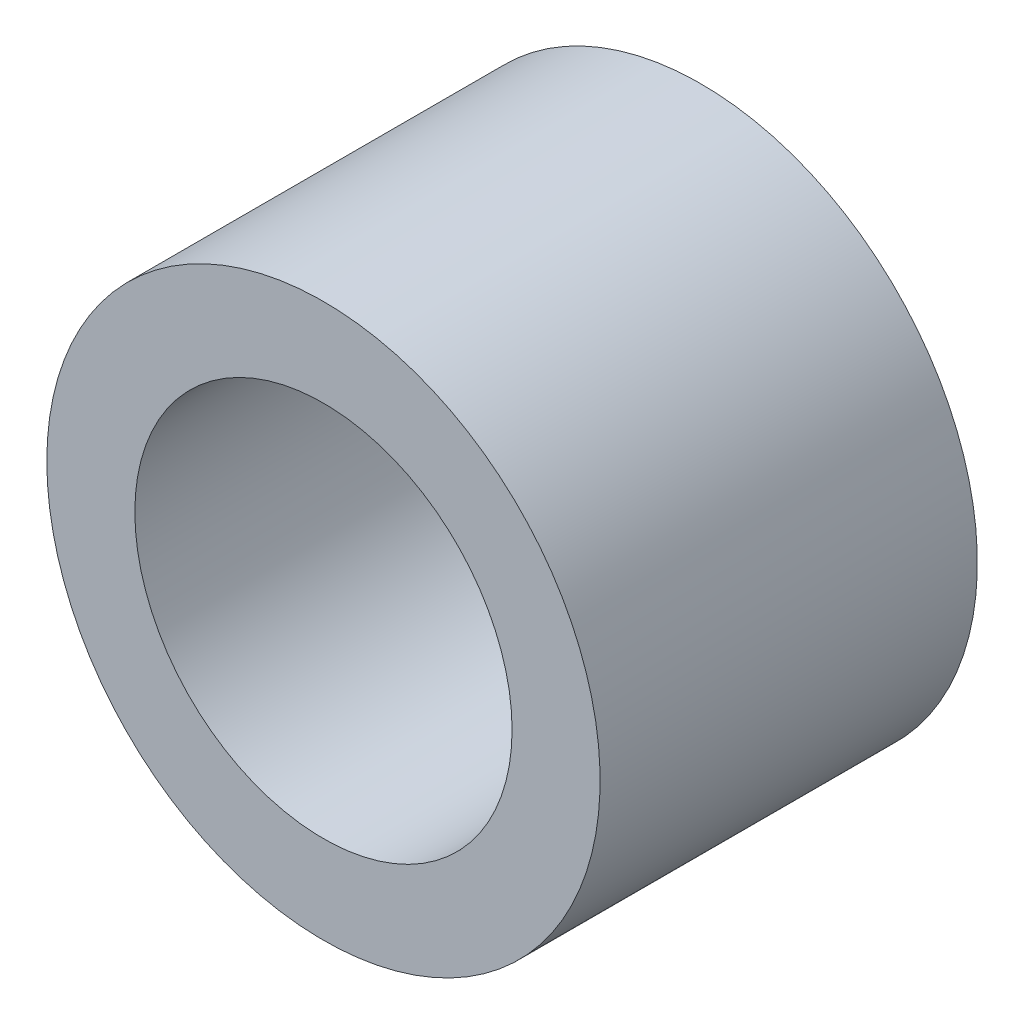
from build123d import *

# Parameters (mm, degrees)
SKETCH1_R           = 5.588
SKETCH1_R_2         = 3.81
BOSS_EXTRUDE1_DEPTH = 7.62


with BuildPart() as part:
    # Sketch1 → Boss-Extrude1 (new body)
    with BuildSketch(Plane.XY):
        with Locations(Location((0, 0, 0), (0, 0, 180))):
            Circle(SKETCH1_R)
        with Locations(Location((0, 0, 0), (0, 0, 180))):
            Circle(SKETCH1_R_2, mode=Mode.SUBTRACT)
    extrude(amount=BOSS_EXTRUDE1_DEPTH)


solid = part.part
